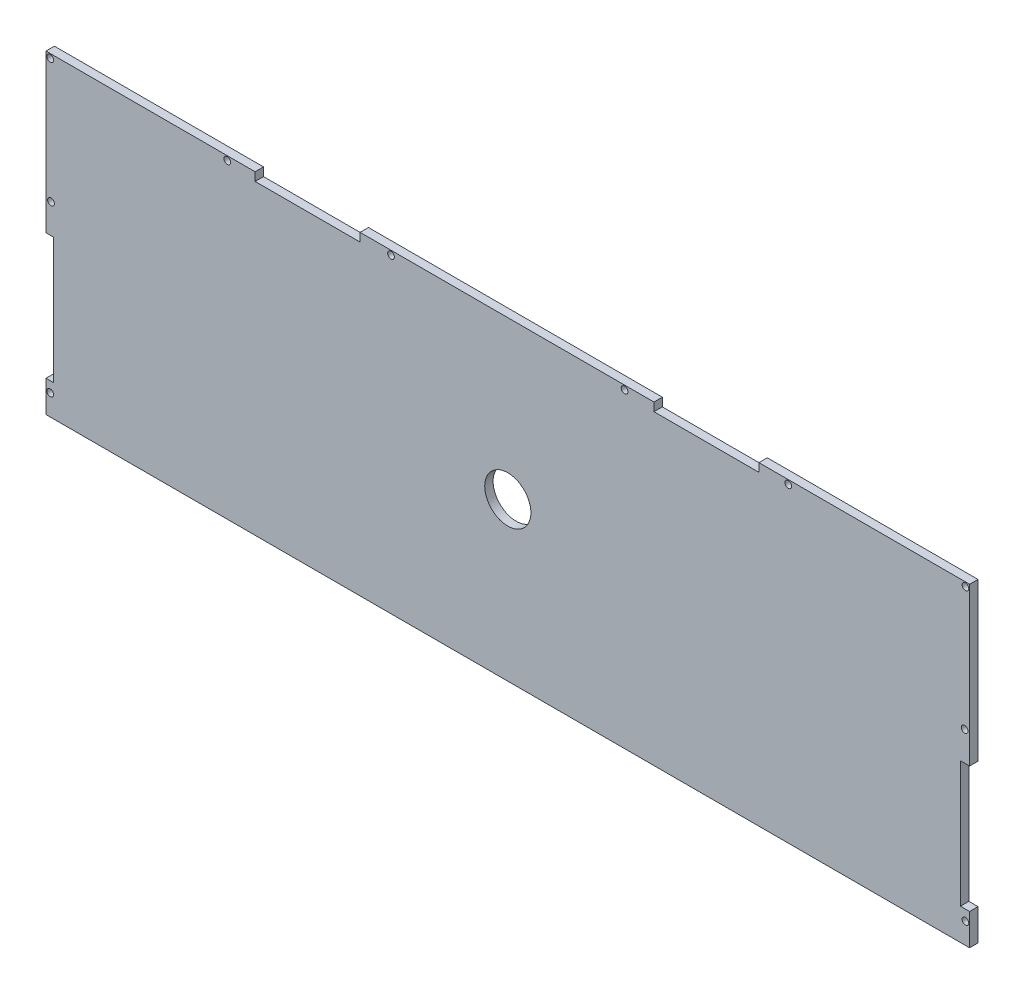
from build123d import *

# Parameters (mm, degrees)
ESQUISSE1_W             = 440
ESQUISSE1_H             = 150
BOSS_EXTRU_1_DEPTH      = 4
ESQUISSE2_R             = 11
ENL_V_MAT_EXTRU_1_DEPTH = 10
ESQUISSE3_W             = 3.624864112
ESQUISSE3_H             = 60
ESQUISSE3_W_2           = 4.375135888
ESQUISSE3_W_3           = 50
ESQUISSE3_H_2           = 4
ENL_V_MAT_EXTRU_2_DEPTH = 4
ESQUISSE4_R             = 1.6
ENL_V_MAT_EXTRU_3_DEPTH = 4


with BuildPart() as part:
    # Esquisse1 → Boss.-Extru.1 (new body)
    with BuildSketch(Plane.XY):
        Rectangle(ESQUISSE1_W, ESQUISSE1_H)
    extrude(amount=BOSS_EXTRU_1_DEPTH)

    # Esquisse2 → Enlèv. mat.-Extru.1 (cut)
    with BuildSketch(Plane(origin=(0, 0, 0), x_dir=(-1, 0, 0), z_dir=(0, 0, -1))):
        Circle(ESQUISSE2_R)
    extrude(amount=-ENL_V_MAT_EXTRU_1_DEPTH, mode=Mode.SUBTRACT)

    # Esquisse3 → Enlèv. mat.-Extru.2 (cut)
    with BuildSketch(Plane(origin=(0, 0, 0), x_dir=(-1, 0, 0), z_dir=(0, 0, -1))):
        with Locations((218.187567944, -30)):
            Rectangle(ESQUISSE3_W, ESQUISSE3_H)
        with Locations((-217.812432056, -30)):
            Rectangle(ESQUISSE3_W_2, ESQUISSE3_H)
        with Locations((95.375135888, 73)):
            Rectangle(ESQUISSE3_W_3, ESQUISSE3_H_2)
        with Locations((-94.624864112, 73)):
            Rectangle(ESQUISSE3_W_3, ESQUISSE3_H_2)
    extrude(amount=-ENL_V_MAT_EXTRU_2_DEPTH, mode=Mode.SUBTRACT)

    # Esquisse4 → Enlèv. mat.-Extru.3 (cut)
    with BuildSketch(Plane(origin=(0, 0, 0), x_dir=(-1, 0, 0), z_dir=(0, 0, -1))):
        with Locations((-217.624864112, 14)):
            Circle(ESQUISSE4_R)
        with Locations((-218, 73)):
            Circle(ESQUISSE4_R)
        with Locations((-218, -65)):
            Circle(ESQUISSE4_R)
        with Locations((-133.624864112, 73)):
            Circle(ESQUISSE4_R)
        with Locations((-55.624864112, 73)):
            Circle(ESQUISSE4_R)
        with Locations(Location((55.624864112, 73, 0), (0, 0, 180))):
            Circle(ESQUISSE4_R)
        with Locations(Location((133.624864112, 73, 0), (0, 0, 180))):
            Circle(ESQUISSE4_R)
        with Locations(Location((218, -65, 0), (0, 0, 180))):
            Circle(ESQUISSE4_R)
        with Locations(Location((218, 73, 0), (0, 0, 180))):
            Circle(ESQUISSE4_R)
        with Locations(Location((217.624864112, 14, 0), (0, 0, 180))):
            Circle(ESQUISSE4_R)
    extrude(amount=-ENL_V_MAT_EXTRU_3_DEPTH, mode=Mode.SUBTRACT)


solid = part.part
